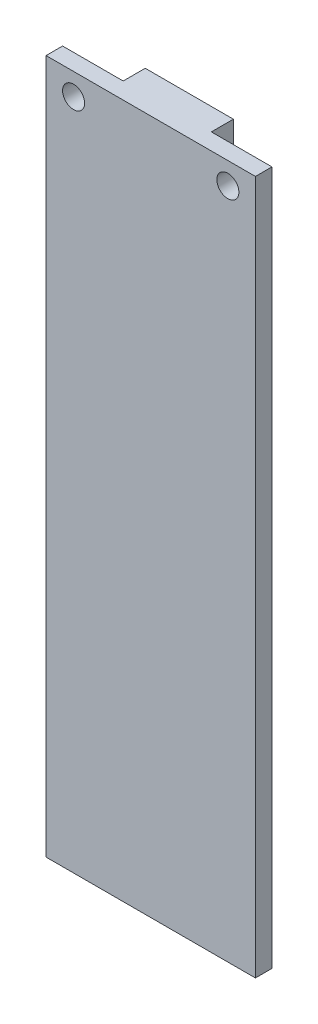
from build123d import *

# Parameters (mm, degrees)
ESQUISSE1_W        = 19
ESQUISSE1_H        = 63
ESQUISSE1_R        = 1
BOSS_EXTRU_1_DEPTH = 1.5
BOSS_EXTRU_2_DEPTH = 2


with BuildPart() as part:
    # Esquisse1 → Boss.-Extru.1 (new body)
    with BuildSketch(Plane.XY):
        Rectangle(ESQUISSE1_W, ESQUISSE1_H)
        with Locations((-7, 29.5)):
            Circle(ESQUISSE1_R, mode=Mode.SUBTRACT)
        with Locations(Location((7, 29.5, 0), (0, 0, 180))):
            Circle(ESQUISSE1_R, mode=Mode.SUBTRACT)
    extrude(amount=BOSS_EXTRU_1_DEPTH)

    # Esquisse2 → Boss.-Extru.2 (add)
    with BuildSketch(Plane(origin=(0, 0, 0), x_dir=(-1, 0, 0), z_dir=(0, 0, -1))):
        with BuildLine():
            Line((-4, 31.5), (-4, 27.5))
            ThreePointArc((-4, 27.5), (-3.707106781, 26.792893219), (-3, 26.5))
            Line((-3, 26.5), (3, 26.5))
            ThreePointArc((3, 26.5), (3.707106781, 26.792893219), (4, 27.5))
            Line((4, 27.5), (4, 31.5))
            Line((4, 31.5), (-4, 31.5))
        make_face()
    extrude(amount=BOSS_EXTRU_2_DEPTH)


solid = part.part
